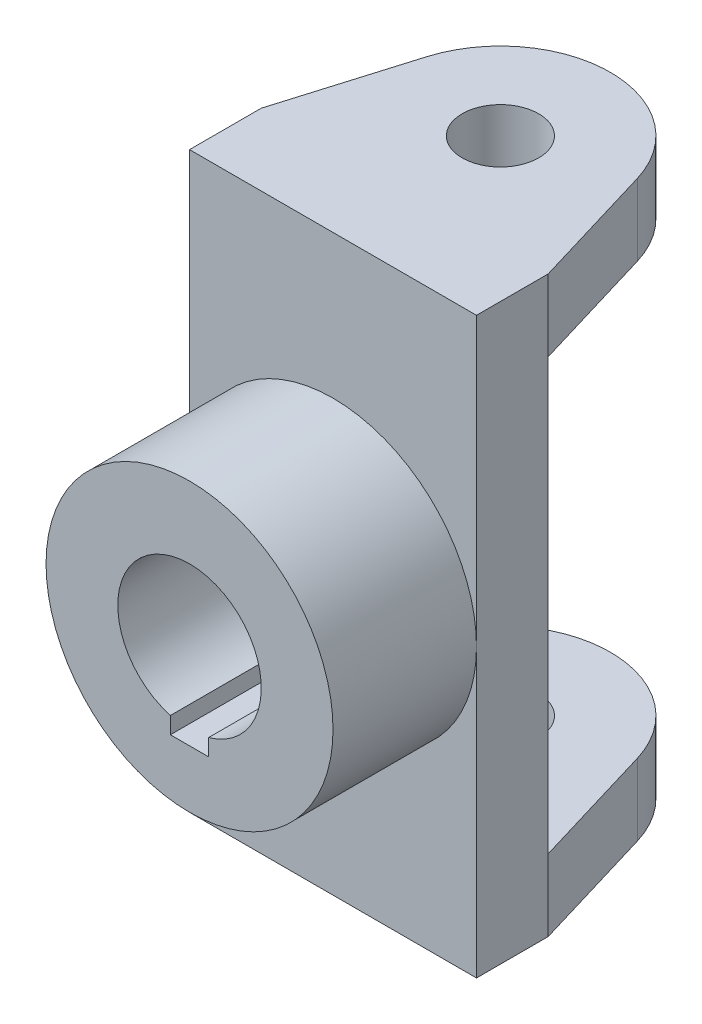
from build123d import *

# Parameters (mm, degrees)
SKETCH1_R           = 30
BOSS_EXTRUDE1_DEPTH = 30
SKETCH2_W           = 60
SKETCH2_H           = 90
BOSS_EXTRUDE2_DEPTH = 15
SKETCH3_R           = 8
BOSS_EXTRUDE3_DEPTH = 15


with BuildPart() as part:
    # Sketch1 → Boss-Extrude1 (new body)
    with BuildSketch(Plane.XY):
        Circle(SKETCH1_R)
        with BuildLine():
            Line((-4, -14.456832295), (-4, -17.956832295))
            Line((-4, -17.956832295), (4, -17.956832295))
            Line((4, -17.956832295), (4, -14.456832295))
            ThreePointArc((4, -14.456832295), (0, 15), (-4, -14.456832295))
        make_face(mode=Mode.SUBTRACT)
    extrude(amount=-BOSS_EXTRUDE1_DEPTH)

    # Sketch2 → Boss-Extrude2 (add)
    with BuildSketch(Plane(origin=(0, 0, -30), x_dir=(-1, 0, 0), z_dir=(0, 0, -1))):
        Rectangle(SKETCH2_W, SKETCH2_H)
    extrude(amount=BOSS_EXTRUDE2_DEPTH)

    # Sketch3 → Boss-Extrude3 (add)
    with BuildSketch(Plane(origin=(0, 45, 0), x_dir=(1, 0, 0), z_dir=(0, 1, 0))):
        with BuildLine():
            Line((-30, 45), (-22.03289839, 71.599347585))
            ThreePointArc((-22.03289839, 71.599347585), (0, 88), (22.03289839, 71.599347585))
            Line((22.03289839, 71.599347585), (30, 45))
            Line((30, 45), (30, 30))
            Line((30, 30), (-30, 30))
            Line((-30, 30), (-30, 45))
        make_face()
        with Locations(Location((0, 65, 0), (0, 0, 180))):
            Circle(SKETCH3_R, mode=Mode.SUBTRACT)
    boss_extrude3 = extrude(amount=BOSS_EXTRUDE3_DEPTH)

    # Mirror1: Boss-Extrude3 across plane
    add(boss_extrude3.mirror(Plane.ZX))


solid = part.part
